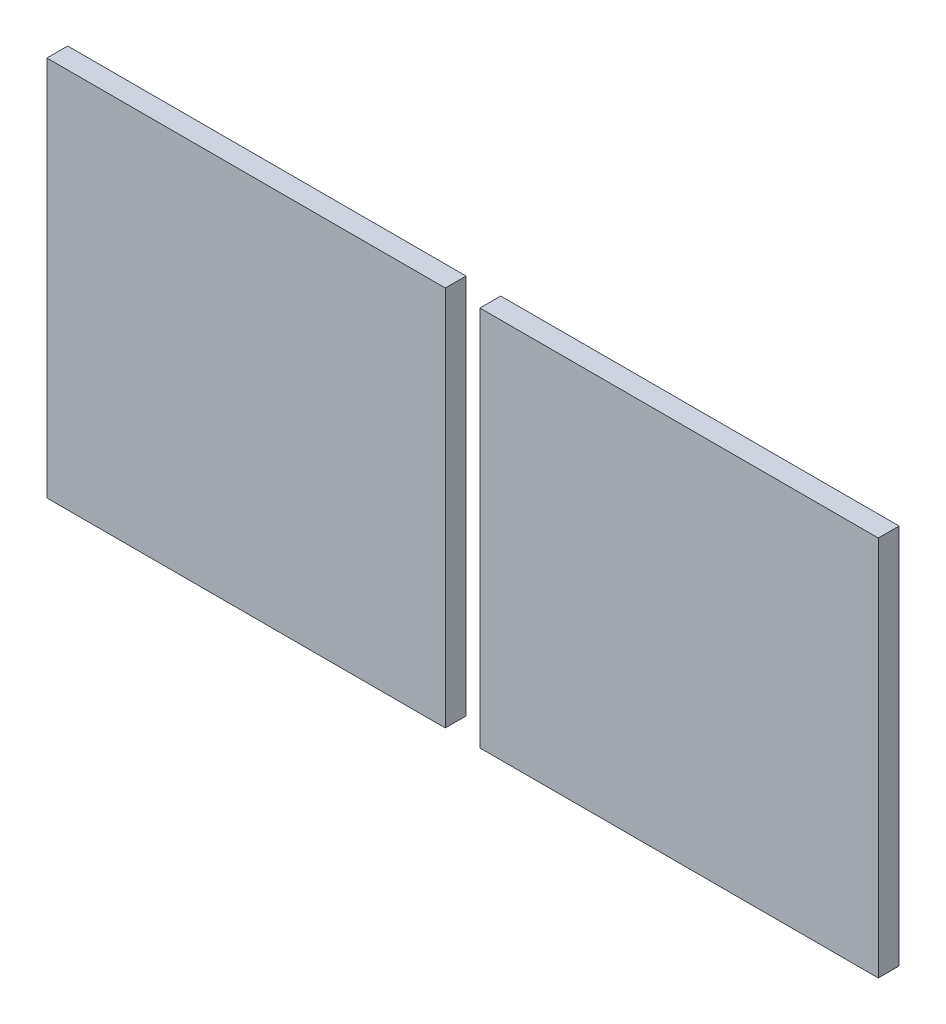
from build123d import *

# Parameters (mm, degrees)
SKETCH1_W             = 57.5
SKETCH1_H             = 55
BOSS_EXTRUDE1_DEPTH   = 3
BOSS_EXTRUDE1_2_DEPTH = 3


with BuildPart() as part:
    # Sketch1 → Boss-Extrude1 (new body)
    with BuildSketch(Plane.XY):
        with Locations((28.75, 27.5)):
            Rectangle(SKETCH1_W, SKETCH1_H)
    extrude(amount=-BOSS_EXTRUDE1_DEPTH)


with BuildPart() as body_2:
    # Sketch1 → Boss-Extrude1 2 (new body)
    with BuildSketch(Plane.XY):
        with Locations((91.25, 27.5)):
            Rectangle(SKETCH1_W, SKETCH1_H)
    extrude(amount=-BOSS_EXTRUDE1_2_DEPTH)


solid = Compound([part.part, body_2.part])
